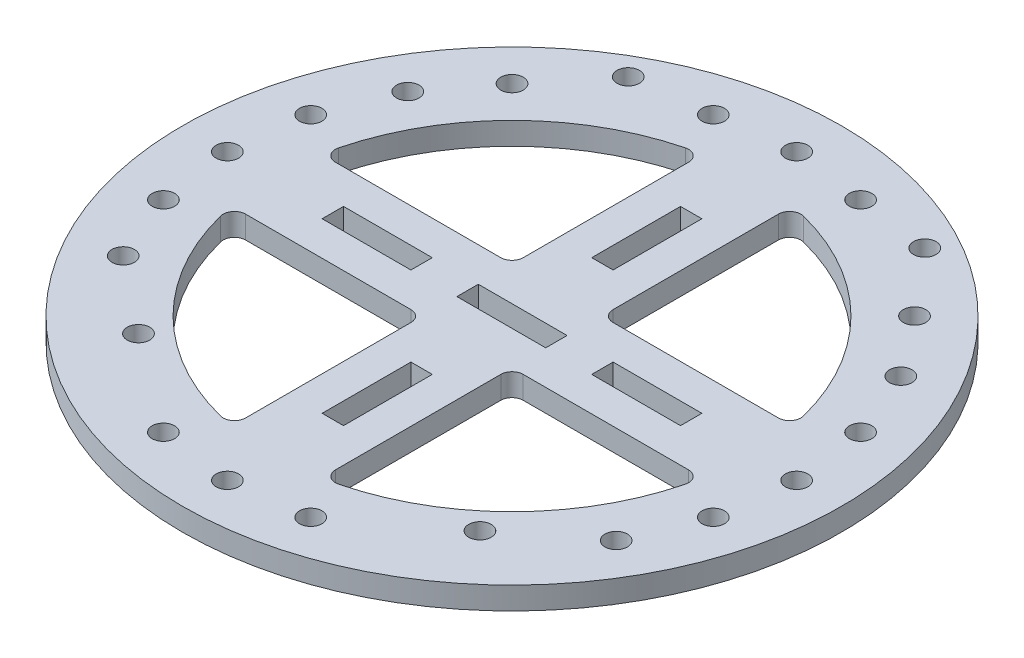
from build123d import *

# Parameters (mm, degrees)
SKETCH1_R           = 46.575911091
SKETCH1_R_2         = 1.587499996
SKETCH1_R_3         = 1.5875
SKETCH1_W           = 3.0226
SKETCH1_H           = 12.5476
SKETCH1_W_2         = 12.5476
SKETCH1_H_2         = 3.0226
SKETCH1_W_3         = 12.547600011
BOSS_EXTRUDE1_DEPTH = 3.175


with BuildPart() as part:
    # Sketch1 → Boss-Extrude1 (new body)
    with BuildSketch(Plane(origin=(0, 0, 0), x_dir=(1, 0, 0), z_dir=(0, 1, 0))):
        with Locations(Location((2.7e-08, -8.701819877, 0), (0, 0, 270))):
            Circle(SKETCH1_R)
        with Locations(Location((3e-08, 31.524091213, 0), (0, 0, 270))):
            Circle(SKETCH1_R_2, mode=Mode.SUBTRACT)
        with Locations(Location((-21.062340002, 28.785905516, 0), (0, 0, 270))):
            Circle(SKETCH1_R_3, mode=Mode.SUBTRACT)
        with Locations(Location((20.847659998, 28.785905516, 0), (0, 0, 270))):
            Circle(SKETCH1_R_3, mode=Mode.SUBTRACT)
        with Locations(Location((24.022659998, -37.254094484, 0), (0, 0, 270))):
            Circle(SKETCH1_R_3, mode=Mode.SUBTRACT)
        with Locations(Location((-24.237340002, -37.254094484, 0), (0, 0, 270))):
            Circle(SKETCH1_R_3, mode=Mode.SUBTRACT)
        with Locations(Location((10.411231927, 30.15342653, 0), (0, 0, 270))):
            Circle(SKETCH1_R_2, mode=Mode.SUBTRACT)
        with Locations(Location((28.444014541, 19.742194633, 0), (0, 0, 270))):
            Circle(SKETCH1_R_2, mode=Mode.SUBTRACT)
        with Locations(Location((34.836660923, 11.411135666, 0), (0, 0, 270))):
            Circle(SKETCH1_R_2, mode=Mode.SUBTRACT)
        with Locations(Location((38.855246436, 1.709412017, 0), (0, 0, 270))):
            Circle(SKETCH1_R_2, mode=Mode.SUBTRACT)
        with Locations(Location((40.225911118, -8.70181988, 0), (0, 0, 270))):
            Circle(SKETCH1_R_2, mode=Mode.SUBTRACT)
        with Locations(Location((38.855246435, -19.113051776, 0), (0, 0, 270))):
            Circle(SKETCH1_R_2, mode=Mode.SUBTRACT)
        with Locations(Location((34.836660921, -28.814775424, 0), (0, 0, 270))):
            Circle(SKETCH1_R_2, mode=Mode.SUBTRACT)
        with Locations(Location((10.411231922, -47.557066286, 0), (0, 0, 270))):
            Circle(SKETCH1_R_2, mode=Mode.SUBTRACT)
        with Locations(Location((2.5e-08, -48.927730968, 0), (0, 0, 270))):
            Circle(SKETCH1_R_2, mode=Mode.SUBTRACT)
        with Locations(Location((-10.411231872, -47.557066285, 0), (0, 0, 270))):
            Circle(SKETCH1_R_2, mode=Mode.SUBTRACT)
        with Locations(Location((-34.836660868, -28.81477542, 0), (0, 0, 270))):
            Circle(SKETCH1_R_2, mode=Mode.SUBTRACT)
        with Locations(Location((-38.855246381, -19.113051772, 0), (0, 0, 270))):
            Circle(SKETCH1_R_2, mode=Mode.SUBTRACT)
        with Locations(Location((-40.225911063, -8.701819875, 0), (0, 0, 270))):
            Circle(SKETCH1_R_2, mode=Mode.SUBTRACT)
        with Locations(Location((-38.85524638, 1.709412022, 0), (0, 0, 270))):
            Circle(SKETCH1_R_2, mode=Mode.SUBTRACT)
        with Locations(Location((-34.836660866, 11.41113567, 0), (0, 0, 270))):
            Circle(SKETCH1_R_2, mode=Mode.SUBTRACT)
        with Locations(Location((-28.444014482, 19.742194636, 0), (0, 0, 270))):
            Circle(SKETCH1_R_2, mode=Mode.SUBTRACT)
        with Locations(Location((-10.411231867, 30.153426532, 0), (0, 0, 270))):
            Circle(SKETCH1_R_2, mode=Mode.SUBTRACT)
        with BuildLine():
            Line((-6.349999989, -39.99938507), (-6.349999989, -16.639319886))
            ThreePointArc((-6.349999989, -16.639319886), (-6.814967973, -15.516787871), (-7.937499989, -15.051819886))
            Line((-7.937499989, -15.051819886), (-31.2975652, -15.051819886))
            ThreePointArc((-31.2975652, -15.051819886), (-32.55049963, -15.664480636), (-32.836349023, -17.029576972))
            ThreePointArc((-32.836349023, -17.029576972), (-23.953886478, -32.655706367), (-8.327757073, -41.538168895))
            ThreePointArc((-8.327757073, -41.538168895), (-6.962660738, -41.2523195), (-6.349999989, -39.99938507))
        make_face(mode=Mode.SUBTRACT)
        with Locations((1e-09, 10.348180116)):
            Rectangle(SKETCH1_W, SKETCH1_H, mode=Mode.SUBTRACT)
        with BuildLine():
            Line((6.350000022, -39.999385045), (6.350000022, -16.639319886))
            ThreePointArc((6.350000022, -16.639319886), (6.814968007, -15.516787871), (7.937500022, -15.051819886))
            Line((7.937500022, -15.051819886), (31.297565134, -15.051819886))
            ThreePointArc((31.297565134, -15.051819886), (32.550499564, -15.664480636), (32.836348958, -17.029576972))
            ThreePointArc((32.836348958, -17.029576972), (23.95388645, -32.655706329), (8.327757111, -41.538168868))
            ThreePointArc((8.327757111, -41.538168868), (6.962660773, -41.252319477), (6.350000022, -39.999385045))
        make_face(mode=Mode.SUBTRACT)
        with BuildLine():
            Line((-31.297565195, -2.351819884), (-7.937499989, -2.351819884))
            ThreePointArc((-7.937499989, -2.351819884), (-6.814967973, -1.886851899), (-6.349999989, -0.764319884))
            Line((-6.349999989, -0.764319884), (-6.349999989, 22.595745281))
            ThreePointArc((-6.349999989, 22.595745281), (-6.962660738, 23.848679711), (-8.327757073, 24.134529106))
            ThreePointArc((-8.327757073, 24.134529106), (-23.953886471, 15.252066585), (-32.836349018, -0.374062797))
            ThreePointArc((-32.836349018, -0.374062797), (-32.550499626, -1.739159134), (-31.297565195, -2.351819884))
        make_face(mode=Mode.SUBTRACT)
        with Locations((-19.049999999, -8.701819874)):
            Rectangle(SKETCH1_W_2, SKETCH1_H_2, mode=Mode.SUBTRACT)
        with Locations((1.7e-08, -8.701819874)):
            Rectangle(SKETCH1_W_3, SKETCH1_H_2, mode=Mode.SUBTRACT)
        with Locations((19.050000001, -8.701819874)):
            Rectangle(SKETCH1_W_2, SKETCH1_H_2, mode=Mode.SUBTRACT)
        with Locations((1e-09, -27.751819886)):
            Rectangle(SKETCH1_W, SKETCH1_H, mode=Mode.SUBTRACT)
        with BuildLine():
            Line((6.350000022, -0.764319884), (6.350000022, 22.595745256))
            ThreePointArc((6.350000022, 22.595745256), (6.962660773, 23.848679688), (8.327757111, 24.134529079))
            ThreePointArc((8.327757111, 24.134529079), (23.953886443, 15.252066547), (32.836348953, -0.374062797))
            ThreePointArc((32.836348953, -0.374062797), (32.55049956, -1.739159134), (31.297565129, -2.351819884))
            Line((31.297565129, -2.351819884), (7.937500022, -2.351819884))
            ThreePointArc((7.937500022, -2.351819884), (6.814968007, -1.886851899), (6.350000022, -0.764319884))
        make_face(mode=Mode.SUBTRACT)
    extrude(amount=BOSS_EXTRUDE1_DEPTH)


solid = part.part
